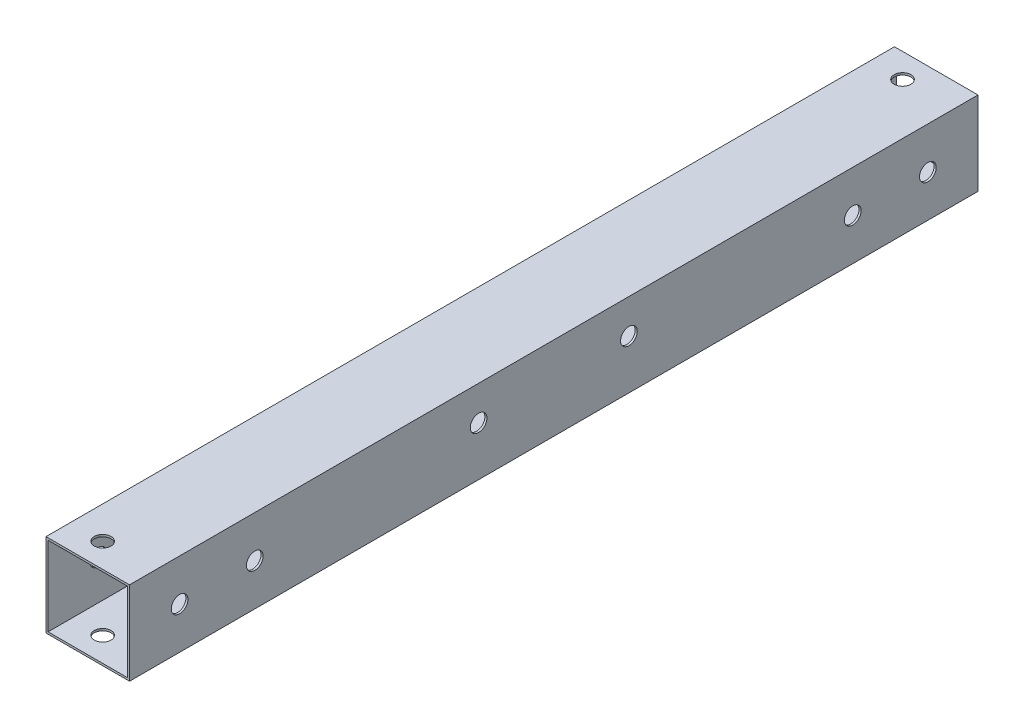
from build123d import *

# Parameters (mm, degrees)
SKETCH_1_W          = 20
SKETCH_1_H          = 20
SKETCH_1_W_2        = 19
SKETCH_1_H_2        = 19
EXTRUDE_1_DEPTH     = 203.2
SKETCH_2_R          = 2
CUT_EXTRUDE_1_DEPTH = 205.426612749
SKETCH_3_R          = 2
CUT_EXTRUDE_2_DEPTH = 205.426612749


with BuildPart() as part:
    # 草图1 → 凸台-拉伸1 (new body)
    with BuildSketch(Plane.XY):
        Rectangle(SKETCH_1_W, SKETCH_1_H)
        Rectangle(SKETCH_1_W_2, SKETCH_1_H_2, mode=Mode.SUBTRACT)
    extrude(amount=-EXTRUDE_1_DEPTH)

    # 草图2 → 切除-拉伸1 (cut, through all)
    with BuildSketch(Plane.ZY.offset(10)):
        with Locations(Location((-30, 0, 0), (0, 0, 270))):
            Circle(SKETCH_2_R)
        with Locations(Location((-83.6, 1.794910396, 0), (0, 0, 270))):
            Circle(SKETCH_2_R)
        with Locations(Location((-119.6, 1.794910396, 0), (0, 0, 270))):
            Circle(SKETCH_2_R)
        with Locations(Location((-173.2, 0, 0), (0, 0, 270))):
            Circle(SKETCH_2_R)
        with Locations(Location((-191.2, 0, 0), (0, 0, 270))):
            Circle(SKETCH_2_R)
        with Locations(Location((-12, 0, 0), (0, 0, 270))):
            Circle(SKETCH_2_R)
    extrude(amount=-CUT_EXTRUDE_1_DEPTH, mode=Mode.SUBTRACT)

    # 草图3 → 切除-拉伸2 (cut, through all)
    with BuildSketch(Plane(origin=(0, 10, 0), x_dir=(1, 0, 0), z_dir=(0, 1, 0))):
        with Locations(Location((-2.25, 197.371407716, 0), (0, 0, 270))):
            Circle(SKETCH_3_R)
        with Locations(Location((-2.25, 5.828592284, 0), (0, 0, 270))):
            Circle(SKETCH_3_R)
    extrude(amount=-CUT_EXTRUDE_2_DEPTH, mode=Mode.SUBTRACT)


solid = part.part
